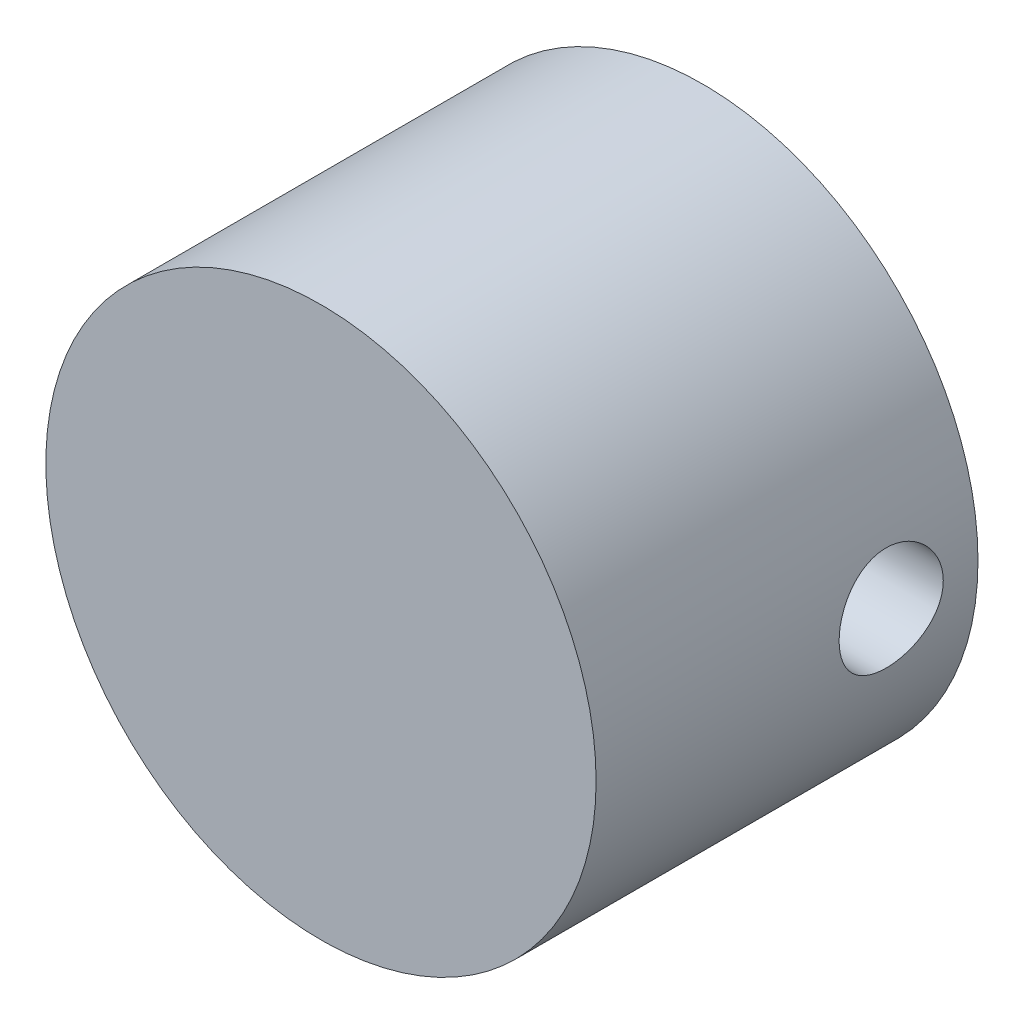
from build123d import *

# Parameters (mm, degrees)
SKETCH1_R               = 7.925
EXTRUDE1_DEPTH          = 11
CUT_EXTRUDE1_DEPTH      = 16.70386099
CUT_EXTRUDE1_DEPTH_BACK = 16.70386099
SKETCH2_R               = 1.5


with BuildPart() as part:
    # Sketch1 → Extrude1 (new body)
    with BuildSketch(Plane.XY):
        Circle(SKETCH1_R)
    extrude(amount=EXTRUDE1_DEPTH)

    # Sketch2 → Cut-Extrude1 (cut, two sides: drawn at the far end of the back side and taken through both)
    with BuildSketch(Plane(origin=(0, 0, 0), x_dir=(0, 0, -1), z_dir=(1, 0, 0)).offset(-CUT_EXTRUDE1_DEPTH_BACK)):
        with Locations(Location((-2.5, 0, 0), (0, 0, 180))):
            Circle(SKETCH2_R)
    extrude(amount=CUT_EXTRUDE1_DEPTH + CUT_EXTRUDE1_DEPTH_BACK, mode=Mode.SUBTRACT)


solid = part.part
